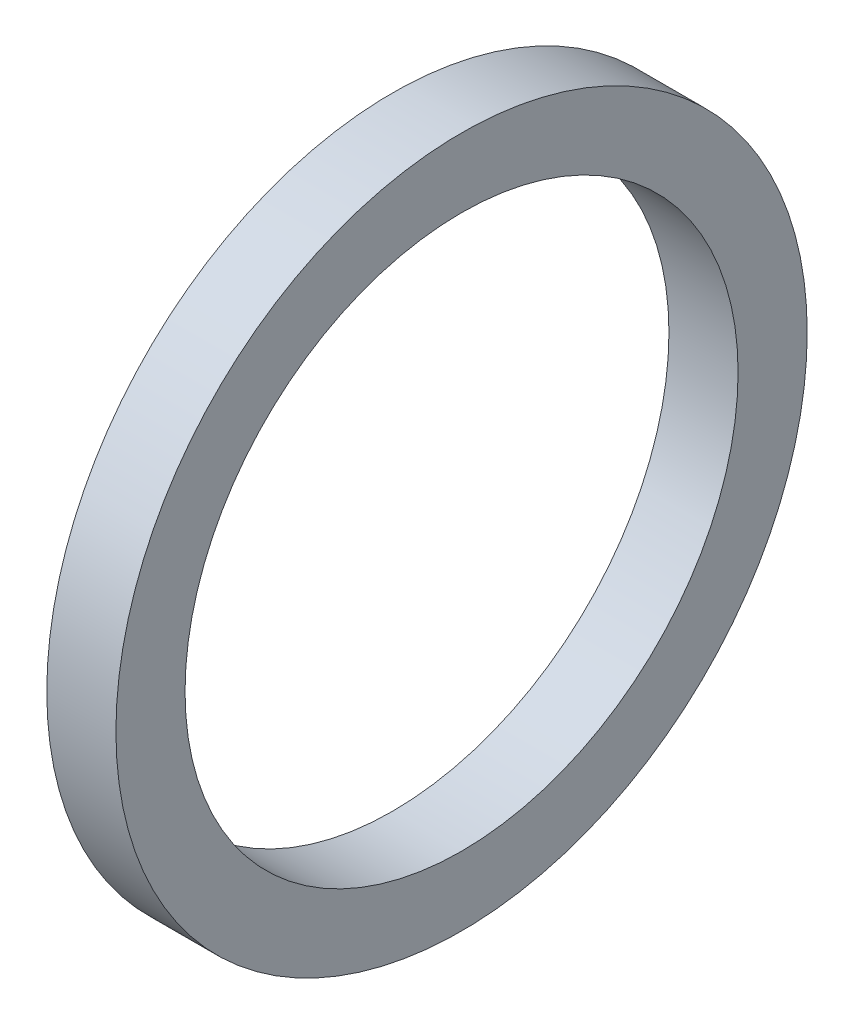
from build123d import *

# Parameters (mm, degrees)
SKETCH1_W = 2
SKETCH1_H = 2


with BuildPart() as part:
    # Sketch1 → Revolve1 (revolve)
    with BuildSketch(Plane.XY, mode=Mode.PRIVATE) as revolve1_sk:
        with Locations((1, 9)):
            Rectangle(SKETCH1_W, SKETCH1_H)
    revolve(revolve1_sk.sketch.rotate(Axis((2, 0, 0), (-1, 0, 0)), 270), axis=Axis((2, 0, 0), (-1, 0, 0)))


solid = part.part
